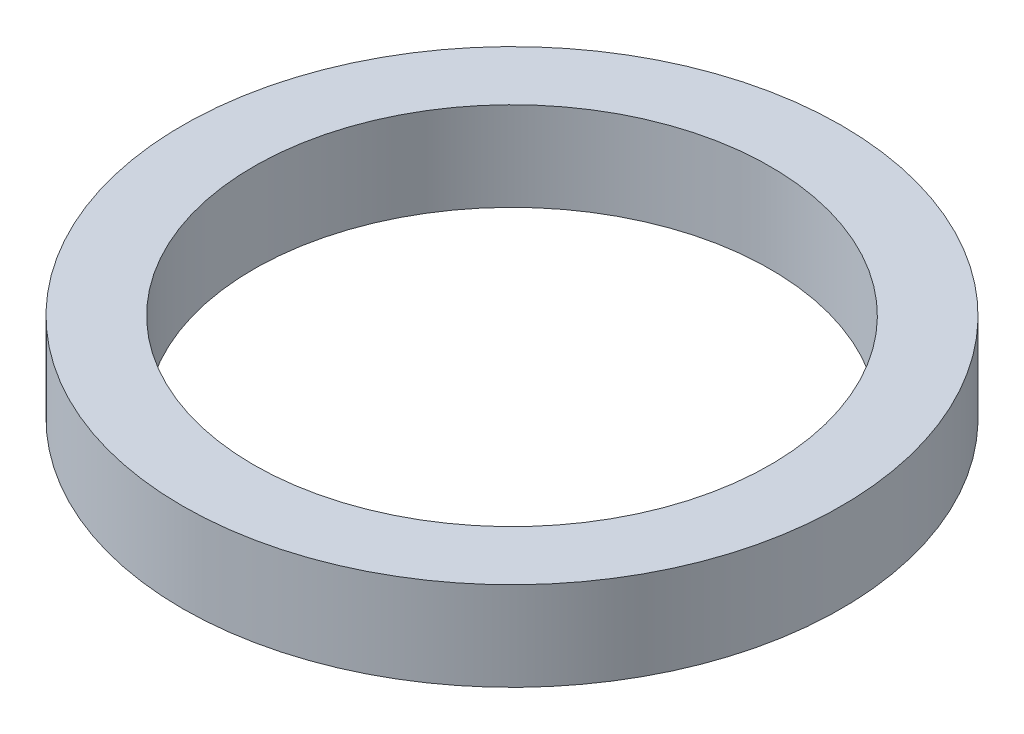
from build123d import *

# Parameters (mm, degrees)
SKETCH1_R           = 21.875
SKETCH1_R_2         = 17.15
BOSS_EXTRUDE1_DEPTH = 5.9


with BuildPart() as part:
    # Sketch1 → Boss-Extrude1 (new body)
    with BuildSketch(Plane(origin=(0, 0, 0), x_dir=(1, 0, 0), z_dir=(0, 1, 0))):
        with Locations(Location((0, 0, 0), (0, 0, 270))):
            Circle(SKETCH1_R)
        with Locations(Location((0, 0, 0), (0, 0, 270))):
            Circle(SKETCH1_R_2, mode=Mode.SUBTRACT)
    extrude(amount=BOSS_EXTRUDE1_DEPTH)


solid = part.part
